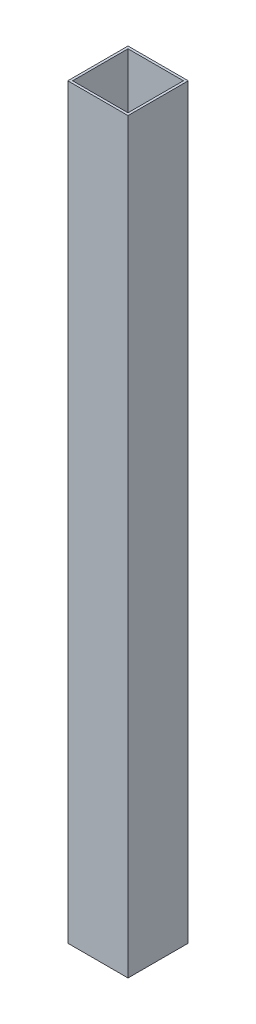
from build123d import *

# Parameters (mm, degrees)
SKETCH1_W           = 25
SKETCH1_H           = 25
SKETCH1_W_2         = 23
SKETCH1_H_2         = 23
BOSS_EXTRUDE1_DEPTH = 310


with BuildPart() as part:
    # Sketch1 → Boss-Extrude1 (new body)
    with BuildSketch(Plane(origin=(0, 25, 0), x_dir=(1, 0, 0), z_dir=(0, 1, 0))):
        with Locations((-31.915591248, -12.5)):
            Rectangle(SKETCH1_W, SKETCH1_H)
        with Locations((-31.915591248, -12.5)):
            Rectangle(SKETCH1_W_2, SKETCH1_H_2, mode=Mode.SUBTRACT)
    extrude(amount=BOSS_EXTRUDE1_DEPTH)


solid = part.part
